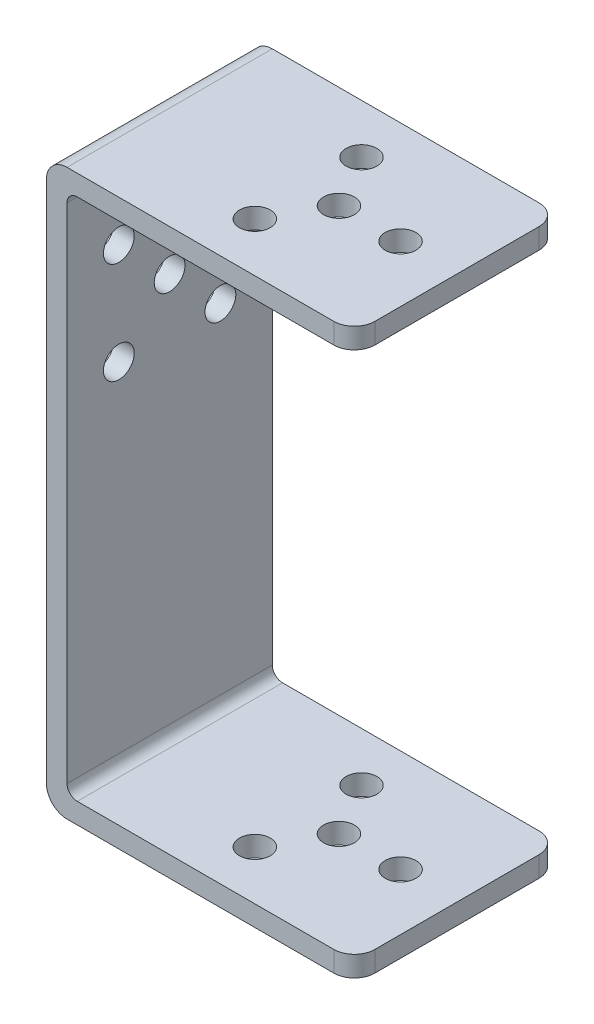
from build123d import *

# Parameters (mm, degrees)
EXTRUDE_1_DEPTH     = 20
SKETCH_2_R          = 1.5
CUT_EXTRUDE_1_DEPTH = 10
SKETCH_4_R          = 1.5
CUT_EXTRUDE_2_DEPTH = 66.76473219
FILLET_1_R          = 2
FILLET_2_R          = 1
FILLET_3_R          = 2


with BuildPart() as part:
    # 草图1 → 凸台-拉伸1 (new body)
    with BuildSketch(Plane.XY):
        Polygon((0, 0), (30, 0), (30, 2), (2, 2), (2, 53), (30, 53), (30, 55), (0, 55), align=None)
    extrude(amount=EXTRUDE_1_DEPTH)

    # 草图2 → 切除-拉伸1 (cut)
    with BuildSketch(Plane.ZY):
        with Locations(Location((10, 41, 0), (0, 0, 270))):
            Circle(SKETCH_2_R)
        with Locations(Location((5.050252532, 45.949747468, 0), (0, 0, 270))):
            Circle(SKETCH_2_R)
        with Locations(Location((14.949747468, 45.949747468, 0), (0, 0, 270))):
            Circle(SKETCH_2_R)
        with Locations(Location((14.949747468, 36.050252532, 0), (0, 0, 270))):
            Circle(SKETCH_2_R)
        with Locations(Location((5.050252532, 36.050252532, 0), (0, 0, 270))):
            Circle(SKETCH_2_R)
    extrude(amount=-CUT_EXTRUDE_1_DEPTH, mode=Mode.SUBTRACT)

    # 草图4 → 切除-拉伸2 (cut, through all)
    with BuildSketch(Plane(origin=(0, 55, 0), x_dir=(1, 0, 0), z_dir=(0, 1, 0))):
        with Locations(Location((18.5, -10, 0), (0, 0, 180))):
            Circle(SKETCH_4_R)
        with Locations(Location((24.5, -10, 0), (0, 0, 180))):
            Circle(SKETCH_4_R)
        with Locations(Location((15.5, -15.196152423, 0), (0, 0, 180))):
            Circle(SKETCH_4_R)
        with Locations(Location((15.5, -4.803847577, 0), (0, 0, 180))):
            Circle(SKETCH_4_R)
    extrude(amount=-CUT_EXTRUDE_2_DEPTH, mode=Mode.SUBTRACT)

    # 圆角1
    fillet_1_edges = [part.edges().sort_by_distance(p)[0] for p in [
        (0, 55, 10),
        (0, 0, 10),
    ]]
    fillet(fillet_1_edges, radius=FILLET_1_R)

    # 圆角2
    fillet_2_edges = [part.edges().sort_by_distance(p)[0] for p in [
        (2, 53, 10),
        (2, 2, 10),
    ]]
    fillet(fillet_2_edges, radius=FILLET_2_R)

    # 圆角3
    fillet_3_edges = [part.edges().sort_by_distance(p)[0] for p in [
        (30, 1, 0),
        (30, 1, 20),
        (30, 54, 20),
        (30, 54, 0),
    ]]
    fillet(fillet_3_edges, radius=FILLET_3_R)


solid = part.part
